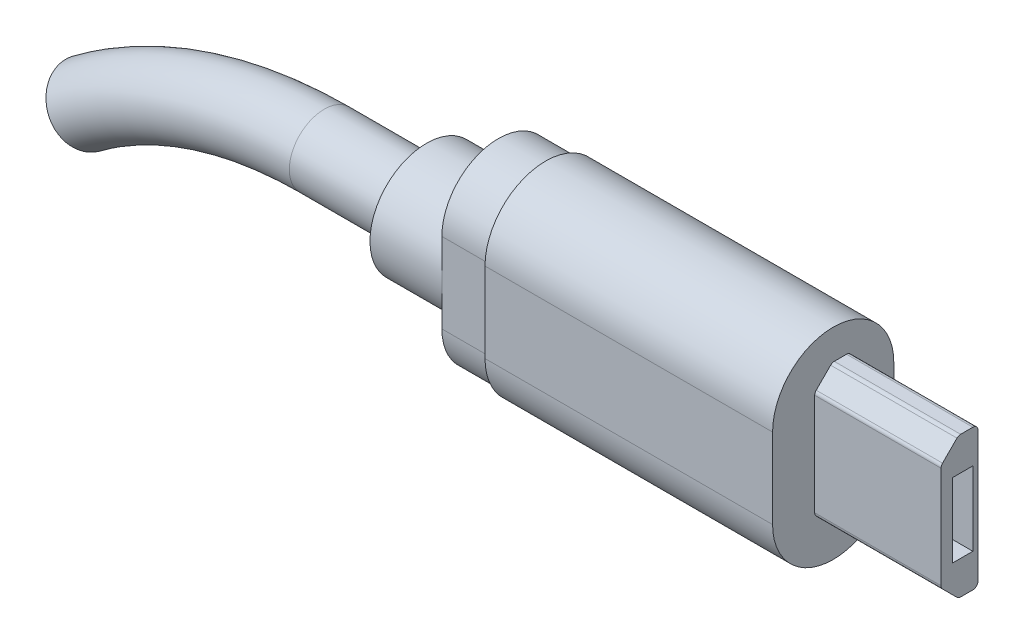
from build123d import *

# Parameters (mm, degrees)
EXTRUDE_1_DEPTH     = 14
EXTRUDE_2_DEPTH     = 2.3
SKETCH_4_R          = 2.75
EXTRUDE_3_DEPTH     = 3.5
SKETCH_5_R          = 1.7
EXTRUDE_4_DEPTH     = 6.15
FILLET_1_R          = 0.25
SKETCH_8_W          = 1
SKETCH_8_H          = 3.6
CUT_EXTRUDE_1_DEPTH = 2.75


with BuildPart() as part:
    # Эскиз1 → Бобышка-Вытянуть1 (new body)
    with BuildSketch(Plane(origin=(0, 0, 0), x_dir=(0, 0, -1), z_dir=(1, 0, 0))):
        with BuildLine():
            Line((-2.95, -1.95), (-2.95, 1.95))
            ThreePointArc((-2.95, 1.95), (0, 4.9), (2.95, 1.95))
            Line((2.95, 1.95), (2.95, -1.95))
            ThreePointArc((2.95, -1.95), (0, -4.9), (-2.95, -1.95))
        make_face()
    extrude(amount=-EXTRUDE_1_DEPTH)

    # Эскиз3 → Бобышка-Вытянуть2 (add)
    with BuildSketch(Plane.ZY.offset(14)):
        with BuildLine():
            Line((2.75, 1.95), (2.75, -1.95))
            ThreePointArc((2.75, -1.95), (0, -4.7), (-2.75, -1.95))
            Line((-2.75, -1.95), (-2.75, 1.95))
            ThreePointArc((-2.75, 1.95), (0, 4.7), (2.75, 1.95))
        make_face()
    extrude(amount=EXTRUDE_2_DEPTH)

    # Эскиз4 → Бобышка-Вытянуть3 (add)
    with BuildSketch(Plane.ZY.offset(16.3)):
        Circle(SKETCH_4_R)
    extrude(amount=EXTRUDE_3_DEPTH)

    # По траектории1: sweep along a path in Эскиз6
    with BuildLine(Plane.XY) as sweep_1_path:
        Line((-19.8, 0), (-24.776161806, 0))
        ThreePointArc((-24.776161806, 0), (-30.870449905, -0.986593903), (-36.342181829, -3.845591055))
    # Эскиз5 → По траектории1 (sweep)
    with BuildSketch(Plane.ZY.offset(19.8)):
        Circle(SKETCH_5_R)
    sweep(path=sweep_1_path.line)

    # Эскиз7 → Бобышка-Вытянуть4 (add)
    with BuildSketch(Plane(origin=(0, 0, 0), x_dir=(0, 0, -1), z_dir=(1, 0, 0))):
        Polygon((-0.05, -3.43), (-0.9, -2.58), (-0.9, 2.58), (-0.05, 3.43), (0.9, 3.43), (0.9, -3.43), align=None)
    extrude(amount=EXTRUDE_4_DEPTH)

    # Скругление1
    fillet_1_edges = [part.edges().sort_by_distance(p)[0] for p in [
        (3.075, 3.43, -0.9),
        (3.075, 3.43, 0.05),
        (3.075, 2.58, 0.9),
        (3.075, -2.58, 0.9),
        (3.075, -3.43, 0.05),
        (3.075, -3.43, -0.9),
    ]]
    fillet(fillet_1_edges, radius=FILLET_1_R)

    # Эскиз8 → Вырез-Вытянуть1 (cut)
    with BuildSketch(Plane(origin=(6.15, 0, 0), x_dir=(0, 0, -1), z_dir=(1, 0, 0))):
        with Locations((0.15, 0)):
            Rectangle(SKETCH_8_W, SKETCH_8_H)
    extrude(amount=-CUT_EXTRUDE_1_DEPTH, mode=Mode.SUBTRACT)


solid = part.part
